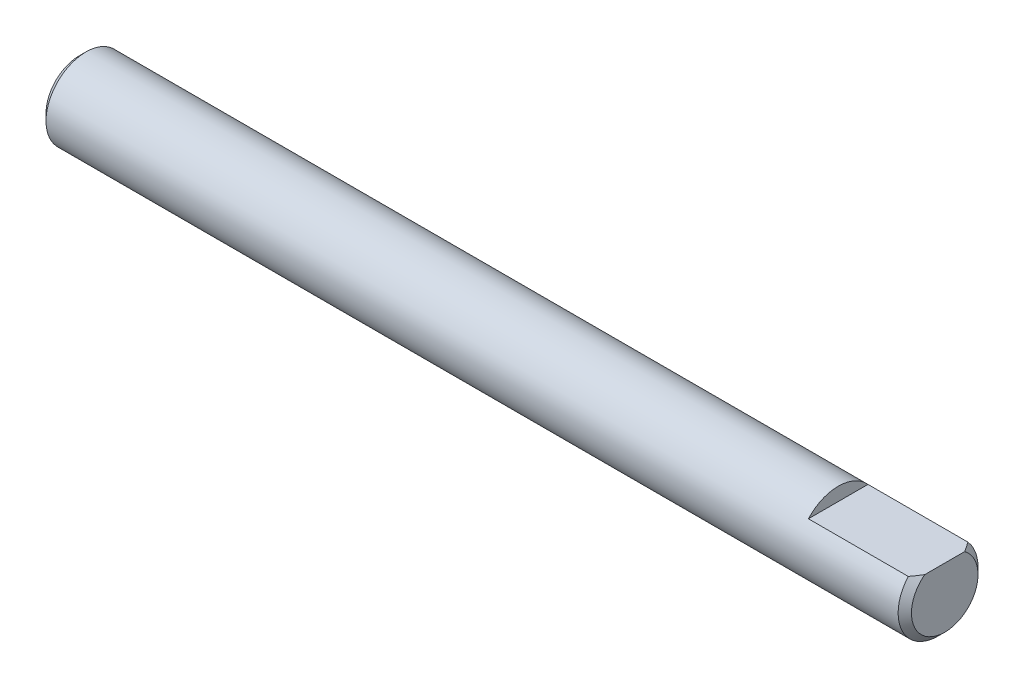
from build123d import *

# Parameters (mm, degrees)
SKETCH1_R           = 3
BOSS_EXTRUDE1_DEPTH = 32.5
CUT_EXTRUDE1_DEPTH  = 8
CHAMFER1_SIZE       = 0.5


with BuildPart() as part:
    # Sketch1 → Boss-Extrude1 (new, symmetric)
    with BuildSketch(Plane(origin=(0, 0, 0), x_dir=(0, 0, -1), z_dir=(1, 0, 0))):
        Circle(SKETCH1_R)
    extrude(amount=BOSS_EXTRUDE1_DEPTH, both=True)

    # Sketch2 → Cut-Extrude1 (cut)
    with BuildSketch(Plane(origin=(32.5, 0, 0), x_dir=(0, 0, -1), z_dir=(1, 0, 0))):
        with BuildLine():
            Line((-2.236067977, 2), (2.236067977, 2))
            ThreePointArc((2.236067977, 2), (0, 3), (-2.236067977, 2))
        make_face()
    extrude(amount=-CUT_EXTRUDE1_DEPTH, mode=Mode.SUBTRACT)

    # Chamfer1
    chamfer1_edges = [part.edges().sort_by_distance(p)[0] for p in [
        (-32.5, 0, 3),
        (32.5, -2.802517077, 1.070466269),
    ]]
    chamfer(chamfer1_edges, length=CHAMFER1_SIZE)


solid = part.part
